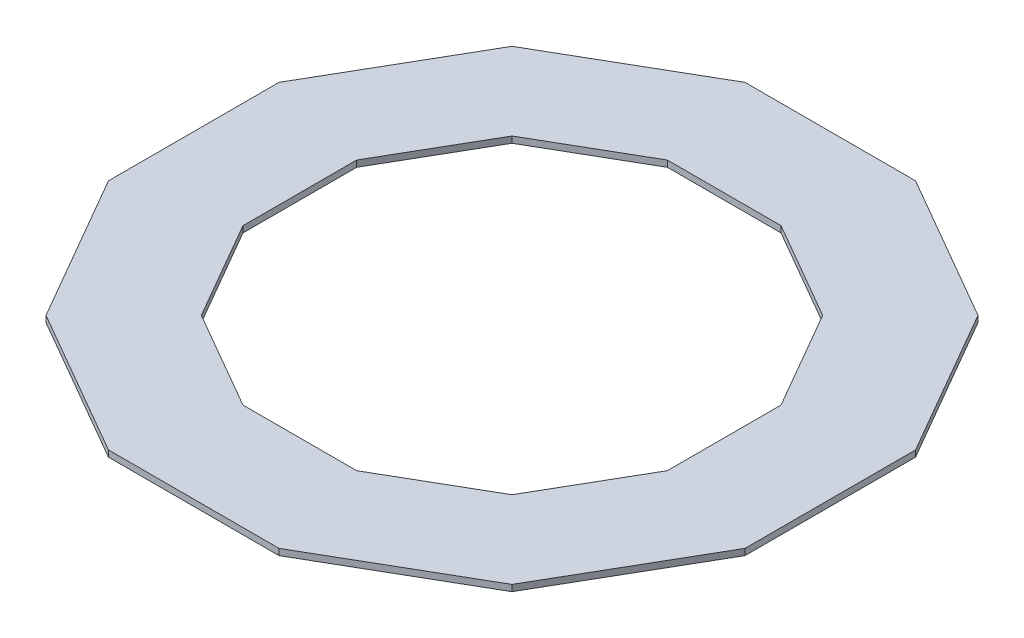
from build123d import *

# Parameters (mm, degrees)
BOSS_EXTRUDE1_DEPTH = 2.921
CUT_EXTRUDE1_DEPTH  = 209.202762766


with BuildPart() as part:
    # Sketch1 → Boss-Extrude1 (new body)
    with BuildSketch(Plane(origin=(0, 0, 0), x_dir=(1, 0, 0), z_dir=(0, 1, 0))):
        Polygon((147.207095926, 39.444022474), (107.763073453, 107.763073453), (39.444022474, 147.207095926), (-39.444022474, 147.207095926), (-107.763073453, 107.763073453), (-147.207095926, 39.444022474), (-147.207095926, -39.444022474), (-107.763073453, -107.763073453), (-39.444022474, -147.207095926), (39.444022474, -147.207095926), (107.763073453, -107.763073453), (147.207095926, -39.444022474), align=None)
    extrude(amount=-BOSS_EXTRUDE1_DEPTH)

    # Sketch3 → Cut-Extrude1 (cut, through all)
    with BuildSketch(Plane(origin=(0, 0, 0), x_dir=(1, 0, 0), z_dir=(0, 1, 0))):
        Polygon((-98.138063951, 26.296014982), (-71.842048969, 71.842048969), (-26.296014982, 98.138063951), (26.296014982, 98.138063951), (71.842048969, 71.842048969), (98.138063951, 26.296014982), (98.138063951, -26.296014982), (71.842048969, -71.842048969), (26.296014982, -98.138063951), (-26.296014982, -98.138063951), (-71.842048969, -71.842048969), (-98.138063951, -26.296014982), align=None)
    extrude(amount=-CUT_EXTRUDE1_DEPTH, mode=Mode.SUBTRACT)


solid = part.part
